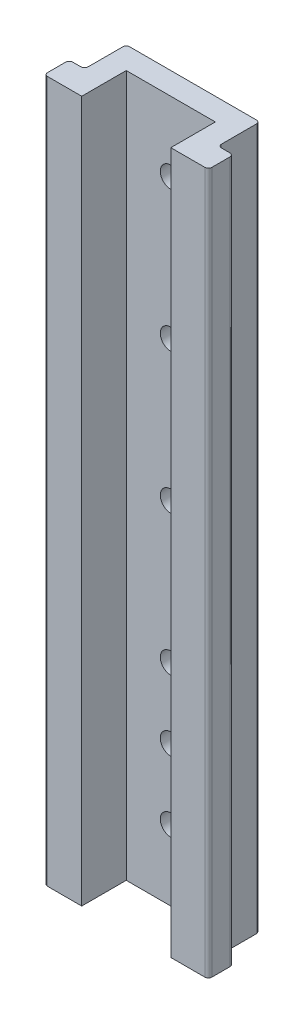
from build123d import *

# Parameters (mm, degrees)
BOSS_EXTRUDE1_DEPTH = 100
CUT_EXTRUDE1_REACH  = 103.133
SKETCH2_R           = 1.5


with BuildPart() as part:
    # Sketch1 → Boss-Extrude1 (new body)
    with BuildSketch(Plane(origin=(0, 0, 0), x_dir=(1, 0, 0), z_dir=(0, 1, 0))):
        with BuildLine():
            Line((11.2078125, 0), (6.35, 0))
            Line((6.35, 0), (6.35, 6.35))
            Line((6.35, 6.35), (-6.35, 6.35))
            Line((-6.35, 6.35), (-6.35, 0))
            Line((-6.35, 0), (-11.2078125, 0))
            ThreePointArc((-11.2078125, 0), (-11.561365891, 0.146446609), (-11.7078125, 0.5))
            Line((-11.7078125, 0.5), (-11.7078125, 3.071875))
            ThreePointArc((-11.7078125, 3.071875), (-11.561365891, 3.425428391), (-11.2078125, 3.571875))
            Line((-11.2078125, 3.571875), (-10.025, 3.571875))
            ThreePointArc((-10.025, 3.571875), (-9.671446609, 3.718321609), (-9.525, 4.071875))
            Line((-9.525, 4.071875), (-9.525, 9.025))
            ThreePointArc((-9.525, 9.025), (-9.378553391, 9.378553391), (-9.025, 9.525))
            Line((-9.025, 9.525), (9.025, 9.525))
            ThreePointArc((9.025, 9.525), (9.378553391, 9.378553391), (9.525, 9.025))
            Line((9.525, 9.025), (9.525, 4.071875))
            ThreePointArc((9.525, 4.071875), (9.671446609, 3.718321609), (10.025, 3.571875))
            Line((10.025, 3.571875), (11.2078125, 3.571875))
            ThreePointArc((11.2078125, 3.571875), (11.561365891, 3.425428391), (11.7078125, 3.071875))
            Line((11.7078125, 3.071875), (11.7078125, 0.5))
            ThreePointArc((11.7078125, 0.5), (11.561365891, 0.146446609), (11.2078125, 0))
        make_face()
    extrude(amount=BOSS_EXTRUDE1_DEPTH)

    # Sketch2 → Cut-Extrude1 (cut, up to next)
    with BuildSketch(Plane(origin=(0, 0, -9.525), x_dir=(-1, 0, 0), z_dir=(0, 0, -1)), mode=Mode.PRIVATE) as cut_extrude1_sk1:
        with Locations((0, 10)):
            Circle(SKETCH2_R)
    cut_extrude1_tool1 = extrude(cut_extrude1_sk1.sketch, amount=-CUT_EXTRUDE1_REACH, mode=Mode.PRIVATE) & part.part
    # Sketch2 → Cut-Extrude1 (cut, up to next)
    with BuildSketch(Plane(origin=(0, 0, -9.525), x_dir=(-1, 0, 0), z_dir=(0, 0, -1)), mode=Mode.PRIVATE) as cut_extrude1_sk2:
        with Locations((0, 20)):
            Circle(SKETCH2_R)
    cut_extrude1_tool2 = extrude(cut_extrude1_sk2.sketch, amount=-CUT_EXTRUDE1_REACH, mode=Mode.PRIVATE) & part.part
    # Sketch2 → Cut-Extrude1 (cut, up to next)
    with BuildSketch(Plane(origin=(0, 0, -9.525), x_dir=(-1, 0, 0), z_dir=(0, 0, -1)), mode=Mode.PRIVATE) as cut_extrude1_sk3:
        with Locations((0, 30)):
            Circle(SKETCH2_R)
    cut_extrude1_tool3 = extrude(cut_extrude1_sk3.sketch, amount=-CUT_EXTRUDE1_REACH, mode=Mode.PRIVATE) & part.part
    # Sketch2 → Cut-Extrude1 (cut, up to next)
    with BuildSketch(Plane(origin=(0, 0, -9.525), x_dir=(-1, 0, 0), z_dir=(0, 0, -1)), mode=Mode.PRIVATE) as cut_extrude1_sk4:
        with Locations((0, 50)):
            Circle(SKETCH2_R)
    cut_extrude1_tool4 = extrude(cut_extrude1_sk4.sketch, amount=-CUT_EXTRUDE1_REACH, mode=Mode.PRIVATE) & part.part
    # Sketch2 → Cut-Extrude1 (cut, up to next)
    with BuildSketch(Plane(origin=(0, 0, -9.525), x_dir=(-1, 0, 0), z_dir=(0, 0, -1)), mode=Mode.PRIVATE) as cut_extrude1_sk5:
        with Locations((0, 70)):
            Circle(SKETCH2_R)
    cut_extrude1_tool5 = extrude(cut_extrude1_sk5.sketch, amount=-CUT_EXTRUDE1_REACH, mode=Mode.PRIVATE) & part.part
    # Sketch2 → Cut-Extrude1 (cut, up to next)
    with BuildSketch(Plane(origin=(0, 0, -9.525), x_dir=(-1, 0, 0), z_dir=(0, 0, -1)), mode=Mode.PRIVATE) as cut_extrude1_sk6:
        with Locations((0, 90)):
            Circle(SKETCH2_R)
    cut_extrude1_tool6 = extrude(cut_extrude1_sk6.sketch, amount=-CUT_EXTRUDE1_REACH, mode=Mode.PRIVATE) & part.part
    add(cut_extrude1_tool1.solids().sort_by_distance((0, 10, -9.525))[0], mode=Mode.SUBTRACT)
    add(cut_extrude1_tool2.solids().sort_by_distance((0, 20, -9.525))[0], mode=Mode.SUBTRACT)
    add(cut_extrude1_tool3.solids().sort_by_distance((0, 30, -9.525))[0], mode=Mode.SUBTRACT)
    add(cut_extrude1_tool4.solids().sort_by_distance((0, 50, -9.525))[0], mode=Mode.SUBTRACT)
    add(cut_extrude1_tool5.solids().sort_by_distance((0, 70, -9.525))[0], mode=Mode.SUBTRACT)
    add(cut_extrude1_tool6.solids().sort_by_distance((0, 90, -9.525))[0], mode=Mode.SUBTRACT)


solid = part.part
